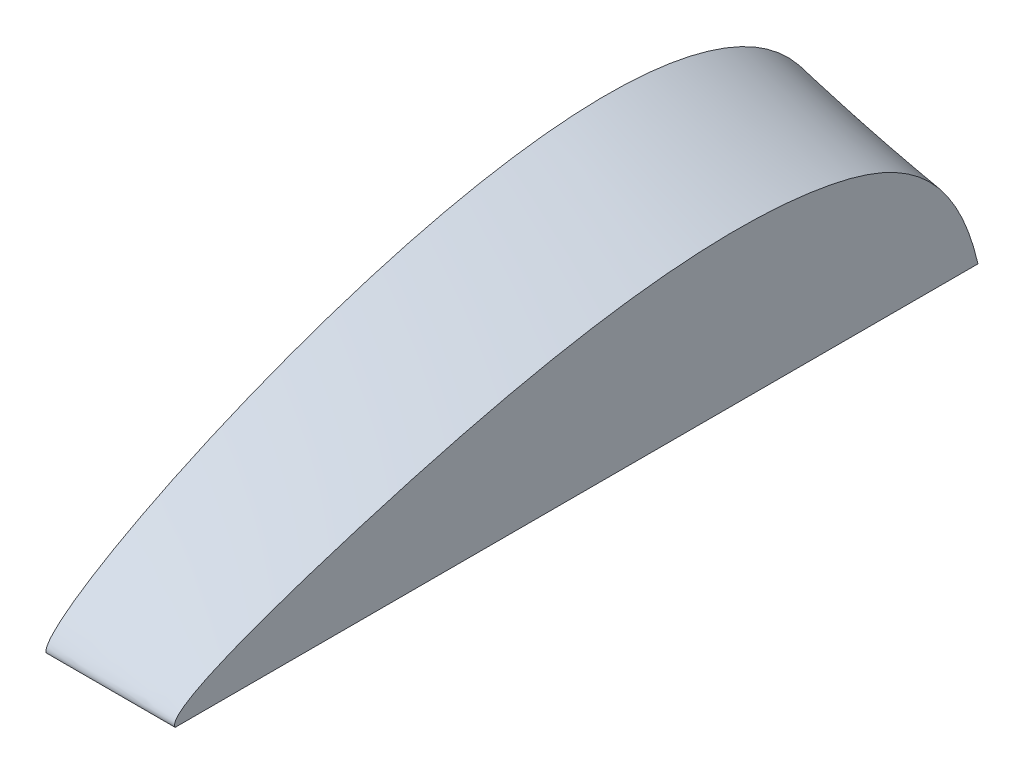
from build123d import *


with BuildPart() as part:
    # Sketch1 → Loft1 section 0
    with BuildSketch(Plane(origin=(0, 0, 0), x_dir=(0, 0, -1), z_dir=(1, 0, 0))):
        with BuildLine():
            Line((-142.24, 0), (142.24, 0))
            add(Edge.make_bspline(
                [(-142.24, 0), (-145.774415003, 14.132978697), (66.605312124, 119.075313212), (136.736962369, 38.690128909), (142.24, 0)],
                knots=[0, 0, 0, 0, 0.781046543, 1, 1, 1, 1], degree=3))
        make_face()
    # Sketch2 → Loft1 section 1
    with BuildSketch(Plane(origin=(45.72, 0, 0), x_dir=(0, 0, -1), z_dir=(1, 0, 0))):
        with BuildLine():
            Line((-142.24, 0), (142.24, 0))
            add(Edge.make_bspline(
                [(-142.24, 0), (-145.252976531, 5.740570619), (-72.043858061, 33.364598734), (72.18262115, 67.099162145), (133.930047256, 35.685006044), (142.24, 0)],
                knots=[0, 0, 0, 0, 0.324251379, 0.769722258, 1, 1, 1, 1], degree=3))
        make_face()
    loft()


solid = part.part
